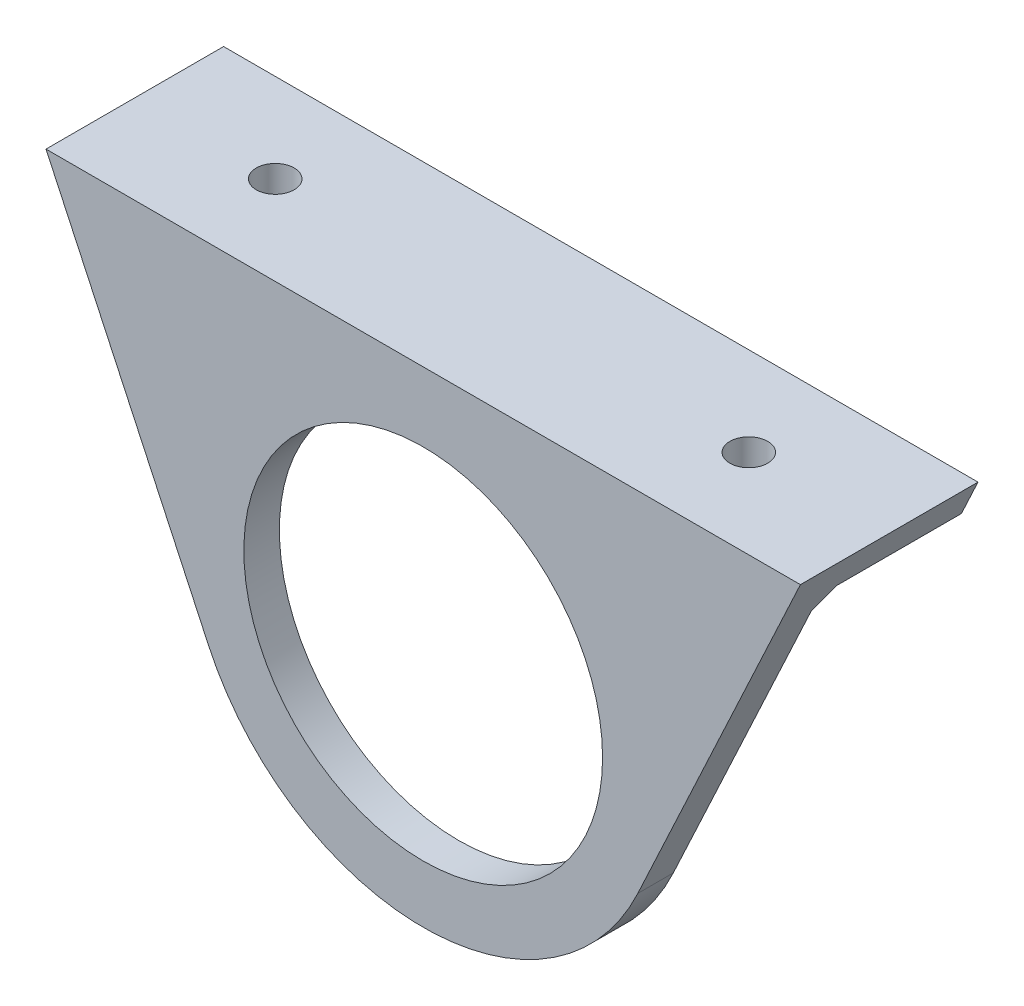
from build123d import *

# Parameters (mm, degrees)
SKETCH_1_R          = 15.15
EXTRUDE_1_DEPTH     = 15
SKETCH_2_W          = 12
SKETCH_2_H          = 38
CUT_EXTRUDE_1_DEPTH = 35
CUT_EXTRUDE_2_REACH = 56.047
SKETCH_3_R          = 1.6
CHAMFER_1_SIZE      = 1.5


with BuildPart() as part:
    # ｽｹｯﾁ1 → ﾎﾞｽ - 押し出し1 (new body)
    with BuildSketch(Plane.XY):
        with BuildLine():
            Line((-18.126155741, -8.452365235), (-31.860019201, 21))
            Line((-31.860019201, 21), (31.860019201, 21))
            Line((31.860019201, 21), (18.126155741, -8.452365235))
            ThreePointArc((18.126155741, -8.452365235), (0, -20), (-18.126155741, -8.452365235))
        make_face()
        Circle(SKETCH_1_R, mode=Mode.SUBTRACT)
    extrude(amount=EXTRUDE_1_DEPTH)

    # ｽｹｯﾁ2 → ｶｯﾄ - 押し出し1 (cut, symmetric)
    with BuildSketch(Plane(origin=(0, 0, 0), x_dir=(0, 0, -1), z_dir=(1, 0, 0))):
        with Locations((-6, -1)):
            Rectangle(SKETCH_2_W, SKETCH_2_H)
    extrude(amount=CUT_EXTRUDE_1_DEPTH, both=True, mode=Mode.SUBTRACT)

    # ｽｹｯﾁ3 → ｶｯﾄ - 押し出し2 (cut, up to next)
    with BuildSketch(Plane(origin=(0, 21, 0), x_dir=(1, 0, 0), z_dir=(0, 1, 0)), mode=Mode.PRIVATE) as cut_extrude_2_sk1:
        with Locations(Location((-20, -7.5, 0), (0, 0, 270))):
            Circle(SKETCH_3_R)
    cut_extrude_2_tool1 = extrude(cut_extrude_2_sk1.sketch, amount=-CUT_EXTRUDE_2_REACH, mode=Mode.PRIVATE) & part.part
    # ｽｹｯﾁ3 → ｶｯﾄ - 押し出し2 (cut, up to next)
    with BuildSketch(Plane(origin=(0, 21, 0), x_dir=(1, 0, 0), z_dir=(0, 1, 0)), mode=Mode.PRIVATE) as cut_extrude_2_sk2:
        with Locations(Location((20, -7.5, 0), (0, 0, 270))):
            Circle(SKETCH_3_R)
    cut_extrude_2_tool2 = extrude(cut_extrude_2_sk2.sketch, amount=-CUT_EXTRUDE_2_REACH, mode=Mode.PRIVATE) & part.part
    add(cut_extrude_2_tool1.solids().sort_by_distance((-20, 21, 7.5))[0], mode=Mode.SUBTRACT)
    add(cut_extrude_2_tool2.solids().sort_by_distance((20, 21, 7.5))[0], mode=Mode.SUBTRACT)

    # 面取り1
    chamfer_1_edges = [part.edges().sort_by_distance(p)[0] for p in [
        (0, 18, 12),
    ]]
    chamfer(chamfer_1_edges, length=CHAMFER_1_SIZE)


solid = part.part
